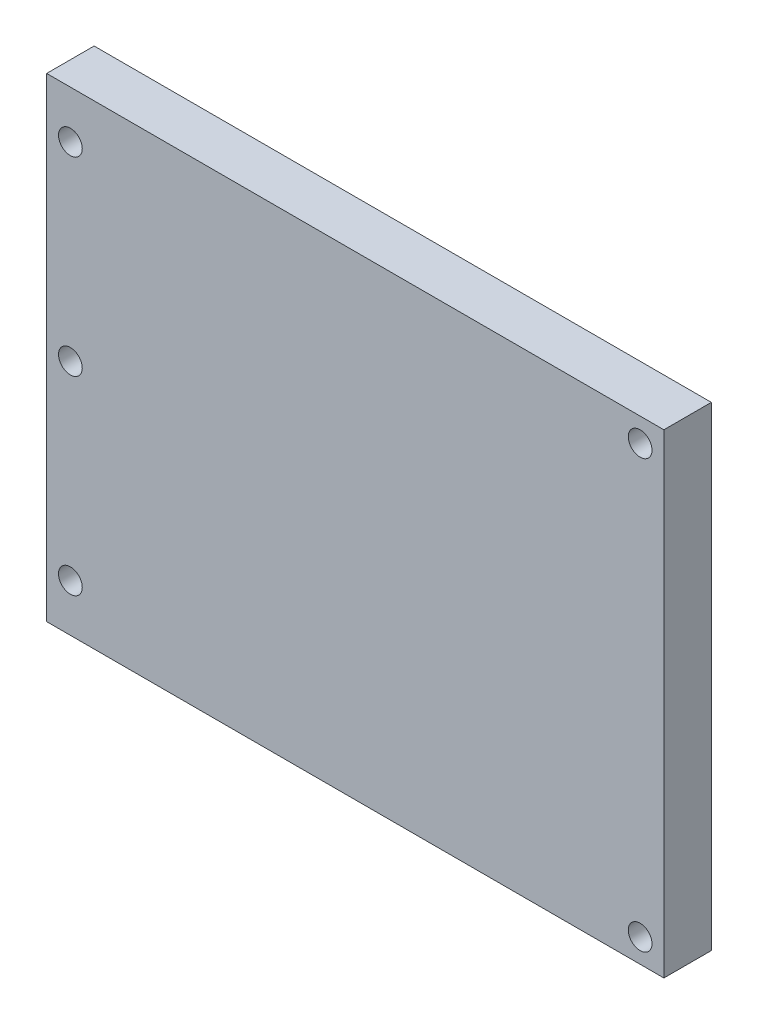
from build123d import *

# Parameters (mm, degrees)
SKETCH_1_W          = 80
SKETCH_1_H          = 40
EXTRUDE_2_DEPTH     = 10
SKETCH_4_W          = 10
SKETCH_4_H          = 40
EXTRUDE_3_DEPTH     = 50
SKETCH_5_R          = 2.5
CUT_EXTRUDE_2_DEPTH = 93.736184955
SKETCH_6_W          = 130
SKETCH_6_H          = 10
EXTRUDE_4_DEPTH     = 30
SKETCH_7_W          = 130
SKETCH_7_H          = 10
EXTRUDE_5_DEPTH     = 30
SKETCH_8_R          = 2.5
CUT_EXTRUDE_3_DEPTH = 104.440804328
SKETCH_10_R         = 2.5
CUT_EXTRUDE_4_DEPTH = 104.440804328


with BuildPart() as part:
    # 草图1 → 凸台-拉伸2 (new body)
    with BuildSketch(Plane.XY):
        Rectangle(SKETCH_1_W, SKETCH_1_H)
    extrude(amount=EXTRUDE_2_DEPTH)

    # 草图4 → 凸台-拉伸3 (add)
    with BuildSketch(Plane.ZY.offset(40)):
        with Locations((5, 0)):
            Rectangle(SKETCH_4_W, SKETCH_4_H)
    extrude(amount=EXTRUDE_3_DEPTH)

    # 草图5 → 切除-拉伸2 (cut, through all)
    with BuildSketch(Plane.XY.offset(10)):
        with Locations((-85, 0)):
            Circle(SKETCH_5_R)
    extrude(amount=-CUT_EXTRUDE_2_DEPTH, mode=Mode.SUBTRACT)

    # 草图6 → 凸台-拉伸4 (add)
    with BuildSketch(Plane.XZ.offset(20)):
        with Locations((-25, 5)):
            Rectangle(SKETCH_6_W, SKETCH_6_H)
    extrude(amount=EXTRUDE_4_DEPTH)

    # 草图7 → 凸台-拉伸5 (add)
    with BuildSketch(Plane(origin=(0, 20, 0), x_dir=(1, 0, 0), z_dir=(0, 1, 0))):
        with Locations((-25, -5)):
            Rectangle(SKETCH_7_W, SKETCH_7_H)
    extrude(amount=EXTRUDE_5_DEPTH)

    # 草图8 → 切除-拉伸3 (cut, through all)
    with BuildSketch(Plane.XY.offset(10)):
        with Locations((35, -45)):
            Circle(SKETCH_8_R)
        with Locations(Location((35, 45, 0), (0, 0, 180))):
            Circle(SKETCH_8_R)
    extrude(amount=-CUT_EXTRUDE_3_DEPTH, mode=Mode.SUBTRACT)

    # 草图10 → 切除-拉伸4 (cut, through all)
    with BuildSketch(Plane.XY.offset(10)):
        with Locations((-85, 40)):
            Circle(SKETCH_10_R)
        with Locations((-85, -40)):
            Circle(SKETCH_10_R)
    extrude(amount=-CUT_EXTRUDE_4_DEPTH, mode=Mode.SUBTRACT)


solid = part.part
